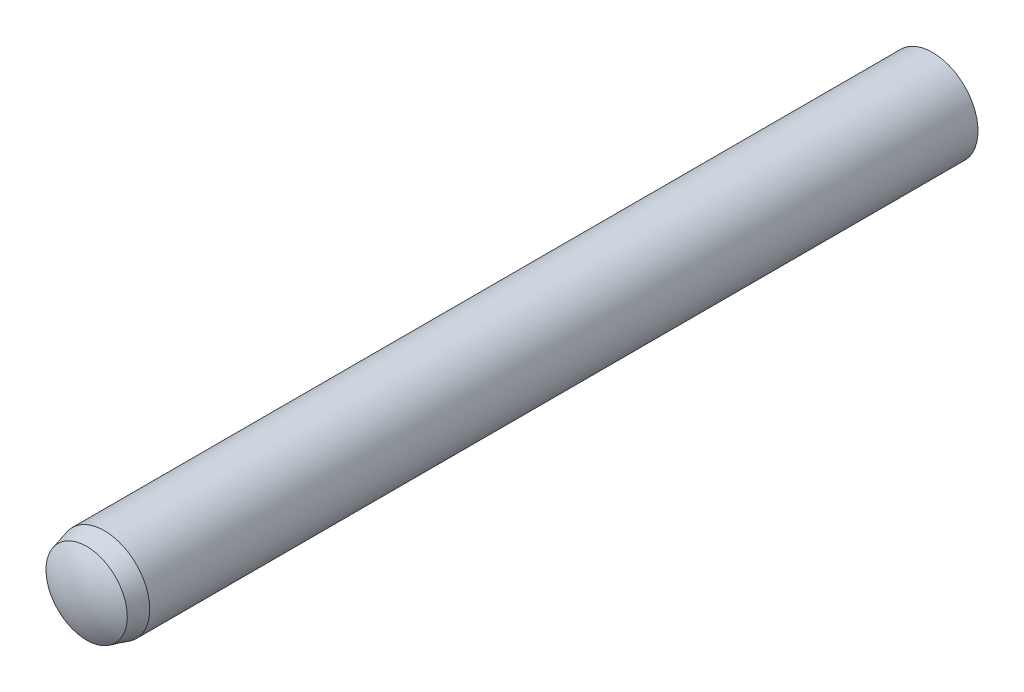
from build123d import *


with BuildPart() as part:
    # Sketch3 → Revolve1 (revolve)
    with BuildSketch(Plane(origin=(0, 0, 0), x_dir=(0, 0, -1), z_dir=(1, 0, 0))):
        with BuildLine():
            Line((-12, 0), (12, 0))
            ThreePointArc((12, 0), (11.904230523, 0.652519157), (11.625, 1.25))
            Line((11.625, 1.25), (-11.1875, 1.25))
            Line((-11.1875, 1.25), (-11.675, 1.119374769))
            ThreePointArc((-11.675, 1.119374769), (-11.917106283, 0.582800324), (-12, 0))
        make_face()
    revolve(axis=Axis((0, 0, 12), (0, 0, -1)))


solid = part.part
